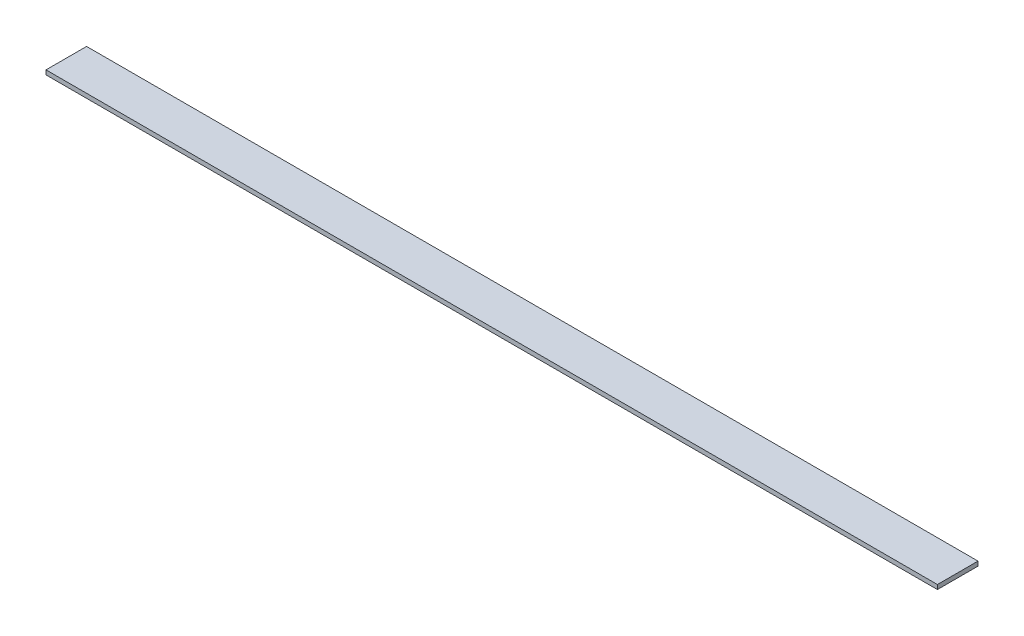
from build123d import *

# Parameters (mm, degrees)
SKETCH1_W           = 406.4
SKETCH1_H           = 18.5
BOSS_EXTRUDE1_DEPTH = 2


with BuildPart() as part:
    # Sketch1 → Boss-Extrude1 (new body)
    with BuildSketch(Plane(origin=(0, 0, 0), x_dir=(1, 0, 0), z_dir=(0, 1, 0))):
        Rectangle(SKETCH1_W, SKETCH1_H)
    extrude(amount=BOSS_EXTRUDE1_DEPTH)


solid = part.part
